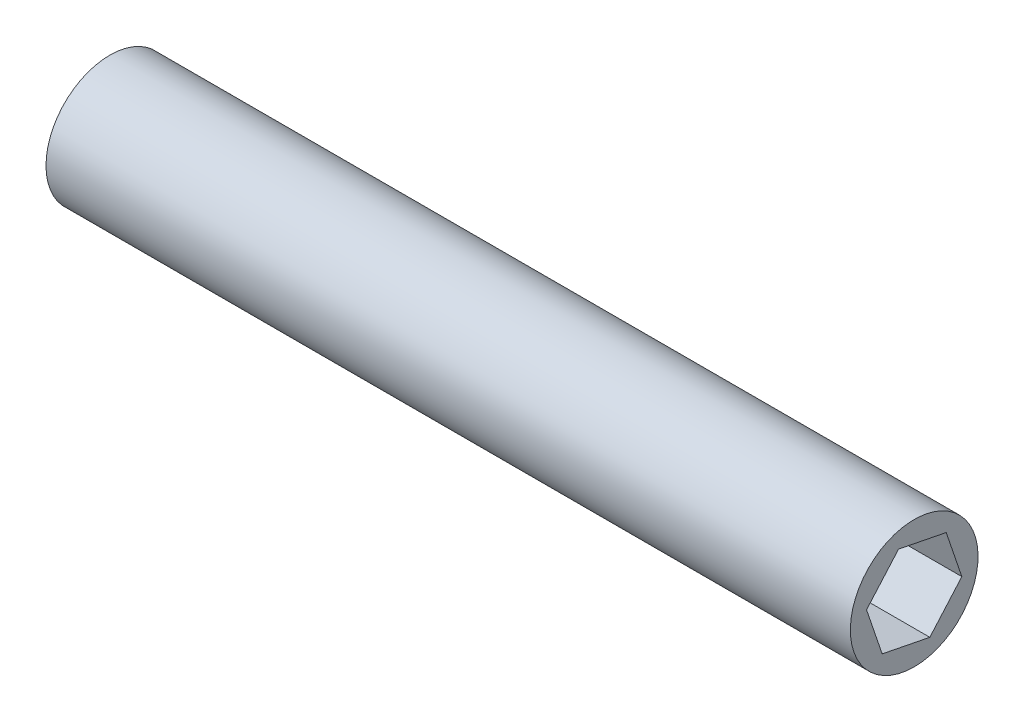
from build123d import *

# Parameters (mm, degrees)
BOSS_EXTRUDE1_DEPTH = 121.6025


with BuildPart() as part:
    # Sketch1 → Boss-Extrude1 (new body)
    with BuildSketch(Plane(origin=(193.3575, 0, 0), x_dir=(0, 0, -1), z_dir=(1, 0, 0))):
        with BuildLine():
            ThreePointArc((169.472564712, 184.756731005), (157.228913048, 190.791231973), (151.19441208, 178.547580309))
            ThreePointArc((151.19441208, 178.547580309), (163.438063744, 172.513079341), (169.472564712, 184.756731005))
        make_face()
        Polygon((157.971317168, 188.605783997), (153.130383991, 183.083269536), (155.492555219, 176.129641196), (162.695659624, 174.698527317), (167.536592801, 180.221041778), (165.174421573, 187.174670118), align=None, mode=Mode.SUBTRACT)
    extrude(amount=BOSS_EXTRUDE1_DEPTH)


solid = part.part
